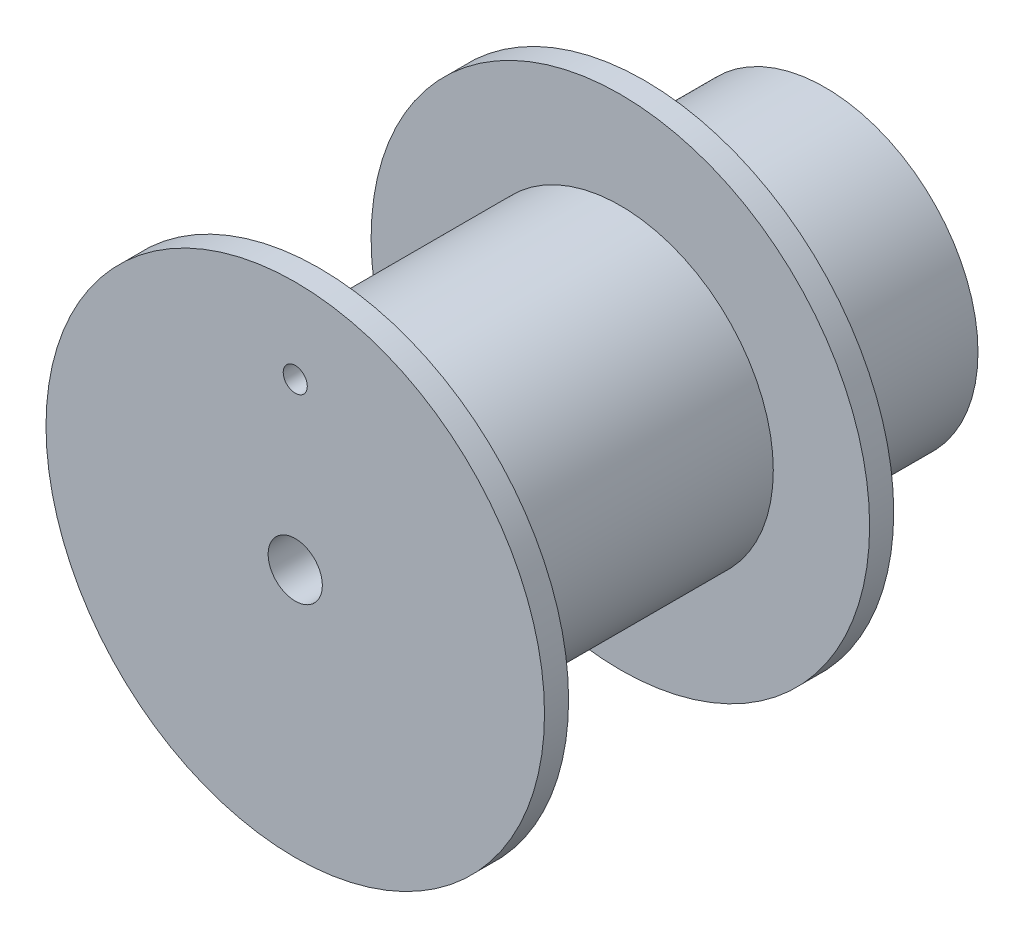
from build123d import *

# Parameters (mm, degrees)
SKETCH1_R           = 12.7
BOSS_EXTRUDE1_DEPTH = 28
SKETCH3_R           = 20.7
SKETCH3_R_2         = 12.7
BOSS_EXTRUDE2_DEPTH = 2
SKETCH4_R           = 12.7
SKETCH4_R_2         = 2.25
BOSS_EXTRUDE3_DEPTH = 14
SKETCH5_R           = 20.7
SKETCH5_R_2         = 2.25
SKETCH5_R_3         = 1
BOSS_EXTRUDE4_DEPTH = 2


with BuildPart() as part:
    # Sketch1 → Boss-Extrude1 (new body)
    with BuildSketch(Plane.XY):
        Circle(SKETCH1_R)
        with BuildLine():
            Line((-2.7, 6.728484228), (-2.7, 10.5))
            Line((-2.7, 10.5), (2.7, 10.5))
            Line((2.7, 10.5), (2.7, 6.728484228))
            ThreePointArc((2.7, 6.728484228), (0, -7.25), (-2.7, 6.728484228))
        make_face(mode=Mode.SUBTRACT)
    extrude(amount=BOSS_EXTRUDE1_DEPTH)

    # Sketch3 → Boss-Extrude2 (add)
    with BuildSketch(Plane(origin=(0, 0, 15), x_dir=(-1, 0, 0), z_dir=(0, 0, -1))):
        Circle(SKETCH3_R)
        Circle(SKETCH3_R_2, mode=Mode.SUBTRACT)
    extrude(amount=-BOSS_EXTRUDE2_DEPTH)

    # Sketch4 → Boss-Extrude3 (add)
    with BuildSketch(Plane.XY.offset(28)):
        with Locations(Location((0, 0, 0), (0, 0, 180))):
            Circle(SKETCH4_R)
        Circle(SKETCH4_R_2, mode=Mode.SUBTRACT)
    extrude(amount=BOSS_EXTRUDE3_DEPTH)

    # Sketch5 → Boss-Extrude4 (add)
    with BuildSketch(Plane.XY.offset(42)):
        with Locations(Location((0, 0, 0), (0, 0, 180))):
            Circle(SKETCH5_R)
        Circle(SKETCH5_R_2, mode=Mode.SUBTRACT)
        with Locations(Location((0, 13.7, 0), (0, 0, 269.999219862))):
            Circle(SKETCH5_R_3, mode=Mode.SUBTRACT)
    extrude(amount=BOSS_EXTRUDE4_DEPTH)


solid = part.part
